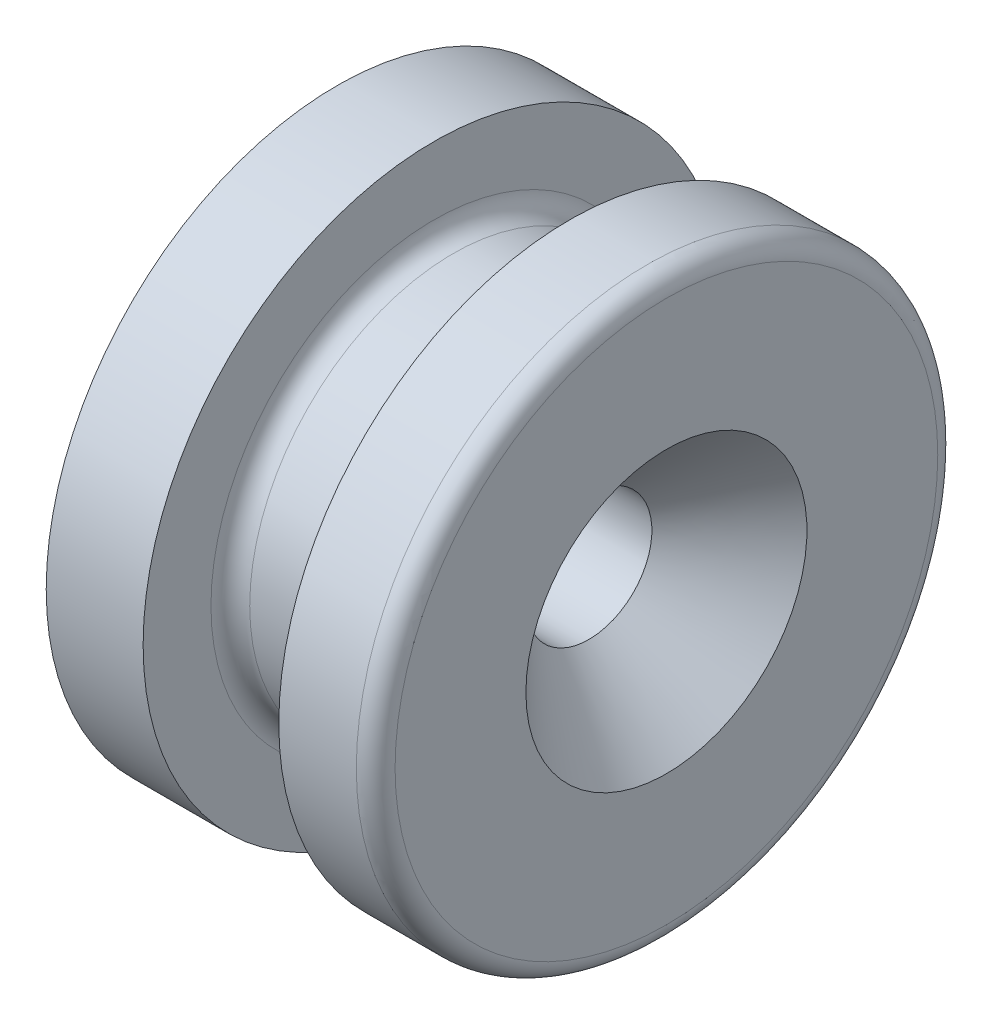
from build123d import *

# Parameters (mm, degrees)
FILLET1_R     = 1
FILLET2_R     = 1
CHAMFER1_SIZE = 4


with BuildPart() as part:
    # Sketch1 → Revolve1 (revolve)
    with BuildSketch(Plane.XY, mode=Mode.PRIVATE) as revolve1_sk:
        Polygon((12, 15), (17, 15), (17, 3.25), (0, 3.25), (0, 15), (5, 15), (5, 10.5), (12, 10.5), align=None)
    revolve(revolve1_sk.sketch.rotate(Axis((-8.121930128, 0, 0), (1, 0, 0)), 90), axis=Axis((-8.121930128, 0, 0), (1, 0, 0)))

    # Fillet1
    fillet1_edges = [part.edges().sort_by_distance(p)[0] for p in [
        (17, 0, -15),
    ]]
    fillet(fillet1_edges, radius=FILLET1_R)

    # Fillet2
    fillet2_edges = [part.edges().sort_by_distance(p)[0] for p in [
        (12, 0, -10.5),
        (5, 0, -10.5),
    ]]
    fillet(fillet2_edges, radius=FILLET2_R)

    # Chamfer1
    chamfer1_edges = [part.edges().sort_by_distance(p)[0] for p in [
        (17, 0, -3.25),
    ]]
    chamfer(chamfer1_edges, length=CHAMFER1_SIZE)


solid = part.part
